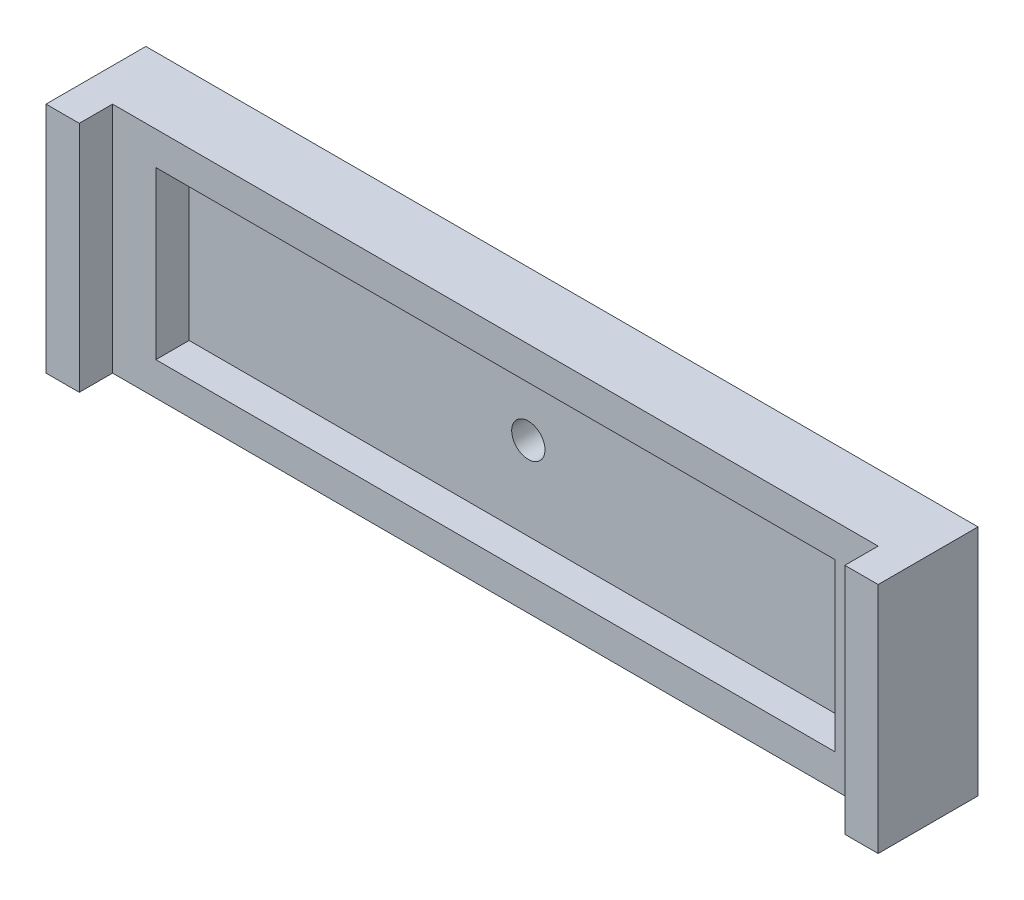
from build123d import *

# Parameters (mm, degrees)
SKETCH1_R           = 5
BOSS_EXTRUDE1_DEPTH = 70
SKETCH3_W           = 50
SKETCH3_H           = 30
CUT_EXTRUDE1_DEPTH  = 266.171642526
SKETCH6_W           = 230
SKETCH6_H           = 50
CUT_EXTRUDE2_DEPTH  = 20
SKETCH7_R           = 5
CUT_EXTRUDE3_DEPTH  = 148.244694302
SKETCH8_W           = 34.830665203
SKETCH8_H           = 70
CUT_EXTRUDE4_DEPTH  = 266.171642526
SKETCH9_W           = 230
SKETCH9_H           = 10
CUT_EXTRUDE5_DEPTH  = 147.372811683
SKETCH10_W          = 13
SKETCH10_H          = 50
BOSS_EXTRUDE4_DEPTH = 10


with BuildPart() as part:
    # Sketch1 → Boss-Extrude1 (new body)
    with BuildSketch(Plane(origin=(0, 0, 0), x_dir=(1, 0, 0), z_dir=(0, 1, 0))):
        with BuildLine():
            Line((-125, 0), (125, 0))
            Line((125, 0), (125, 30))
            Line((125, 30), (119.5, 30))
            Line((119.5, 30), (119.5, 42))
            ThreePointArc((119.5, 42), (107.5, 54), (95.5, 42))
            Line((95.5, 42), (95.5, 30))
            Line((95.5, 30), (-95.5, 30))
            Line((-95.5, 30), (-95.5, 42))
            ThreePointArc((-95.5, 42), (-107.5, 54), (-119.5, 42))
            Line((-119.5, 42), (-119.5, 30))
            Line((-119.5, 30), (-125, 30))
            Line((-125, 30), (-125, 0))
        make_face()
        with Locations(Location((107.5, 42, 0), (0, 0, 270))):
            Circle(SKETCH1_R, mode=Mode.SUBTRACT)
        with Locations(Location((-107.5, 42, 0), (0, 0, 270))):
            Circle(SKETCH1_R, mode=Mode.SUBTRACT)
    extrude(amount=BOSS_EXTRUDE1_DEPTH)

    # Sketch3 → Cut-Extrude1 (cut, through all)
    with BuildSketch(Plane.ZY.offset(125)):
        with Locations((-55, 15)):
            Rectangle(SKETCH3_W, SKETCH3_H)
    extrude(amount=-CUT_EXTRUDE1_DEPTH, mode=Mode.SUBTRACT)

    # Sketch6 → Cut-Extrude2 (cut)
    with BuildSketch(Plane.XY):
        with Locations((0, 35)):
            Rectangle(SKETCH6_W, SKETCH6_H)
    extrude(amount=-CUT_EXTRUDE2_DEPTH, mode=Mode.SUBTRACT)

    # Sketch7 → Cut-Extrude3 (cut, through all)
    with BuildSketch(Plane.XY.offset(-20)):
        with Locations((-0.094237072, 35)):
            Circle(SKETCH7_R)
    extrude(amount=-CUT_EXTRUDE3_DEPTH, mode=Mode.SUBTRACT)

    # Sketch8 → Cut-Extrude4 (cut, through all)
    with BuildSketch(Plane(origin=(125, 0, 0), x_dir=(0, 0, -1), z_dir=(1, 0, 0))):
        with Locations((47.415332602, 35)):
            Rectangle(SKETCH8_W, SKETCH8_H)
    extrude(amount=-CUT_EXTRUDE4_DEPTH, mode=Mode.SUBTRACT)

    # Sketch9 → Cut-Extrude5 (cut, through all)
    with BuildSketch(Plane(origin=(0, 70, 0), x_dir=(1, 0, 0), z_dir=(0, 1, 0))):
        with Locations((0, 5)):
            Rectangle(SKETCH9_W, SKETCH9_H)
    extrude(amount=-CUT_EXTRUDE5_DEPTH, mode=Mode.SUBTRACT)

    # Sketch10 → Boss-Extrude4 (add)
    with BuildSketch(Plane.XY.offset(-20)):
        with Locations((-108.5, 35)):
            Rectangle(SKETCH10_W, SKETCH10_H)
        with Locations((108.5, 35)):
            Rectangle(SKETCH10_W, SKETCH10_H)
    extrude(amount=BOSS_EXTRUDE4_DEPTH)


solid = part.part
